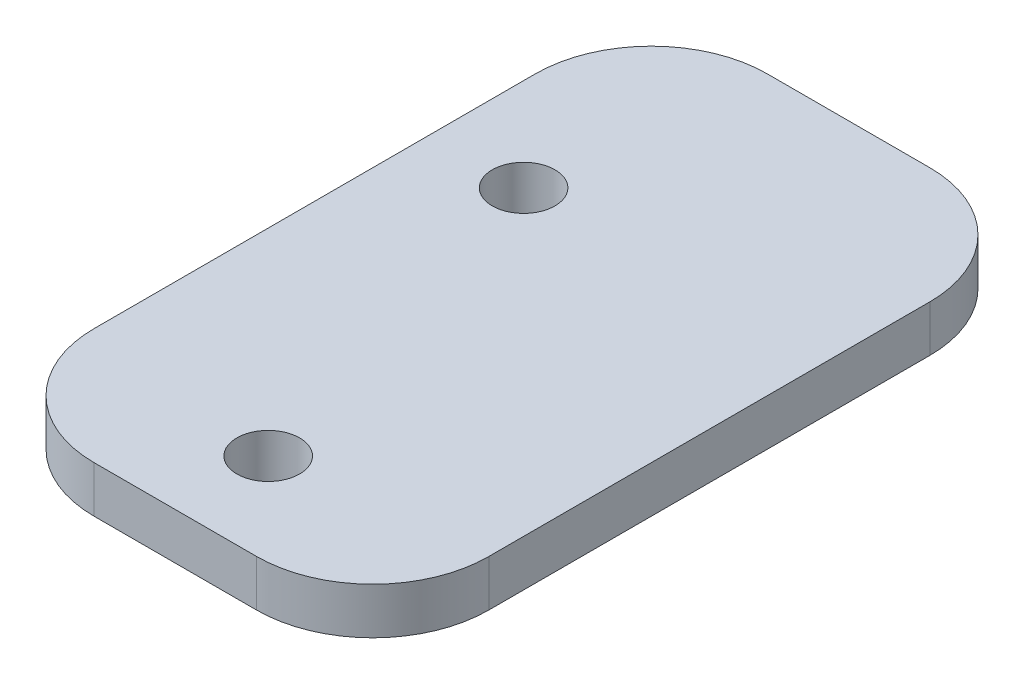
from build123d import *

# Parameters (mm, degrees)
SKETCH_1_W      = 17
SKETCH_1_H      = 29
SKETCH_1_R      = 1.35
EXTRUDE_1_DEPTH = 2
FILLET_1_R      = 5


with BuildPart() as part:
    # 草图1 → 凸台-拉伸1 (new body)
    with BuildSketch(Plane(origin=(0, 0, 0), x_dir=(1, 0, 0), z_dir=(0, 1, 0))):
        Rectangle(SKETCH_1_W, SKETCH_1_H)
        with Locations(Location((0, -10.5, 0), (0, 0, 270))):
            Circle(SKETCH_1_R, mode=Mode.SUBTRACT)
        with Locations(Location((-4.5, 5, 0), (0, 0, 270))):
            Circle(SKETCH_1_R, mode=Mode.SUBTRACT)
    extrude(amount=EXTRUDE_1_DEPTH)

    # 圆角1
    fillet_1_edges = [part.edges().sort_by_distance(p)[0] for p in [
        (8.5, 1, 14.5),
        (-8.5, 1, 14.5),
        (-8.5, 1, -14.5),
        (8.5, 1, -14.5),
    ]]
    fillet(fillet_1_edges, radius=FILLET_1_R)


solid = part.part
